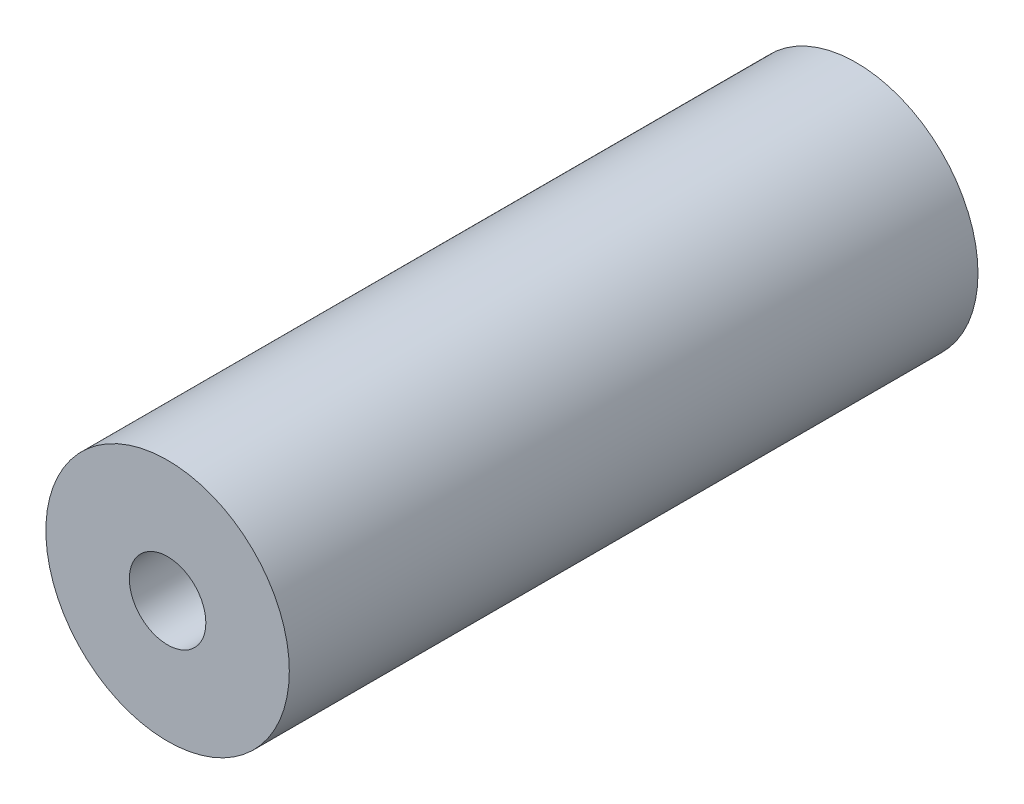
from build123d import *

# Parameters (mm, degrees)
SKETCH1_R           = 17.5
BOSS_EXTRUDE1_DEPTH = 99
SKETCH2_R           = 2.5
CUT_EXTRUDE1_DEPTH  = 103.046558002
SKETCH3_R           = 5.5
CUT_EXTRUDE2_DEPTH  = 94


with BuildPart() as part:
    # Sketch1 → Boss-Extrude1 (new body)
    with BuildSketch(Plane.XY):
        Circle(SKETCH1_R)
    extrude(amount=BOSS_EXTRUDE1_DEPTH)

    # Sketch2 → Cut-Extrude1 (cut, through all)
    with BuildSketch(Plane.XY.offset(99)):
        Circle(SKETCH2_R)
    extrude(amount=-CUT_EXTRUDE1_DEPTH, mode=Mode.SUBTRACT)

    # Sketch3 → Cut-Extrude2 (cut)
    with BuildSketch(Plane.XY.offset(99)):
        Circle(SKETCH3_R)
    extrude(amount=-CUT_EXTRUDE2_DEPTH, mode=Mode.SUBTRACT)


solid = part.part
